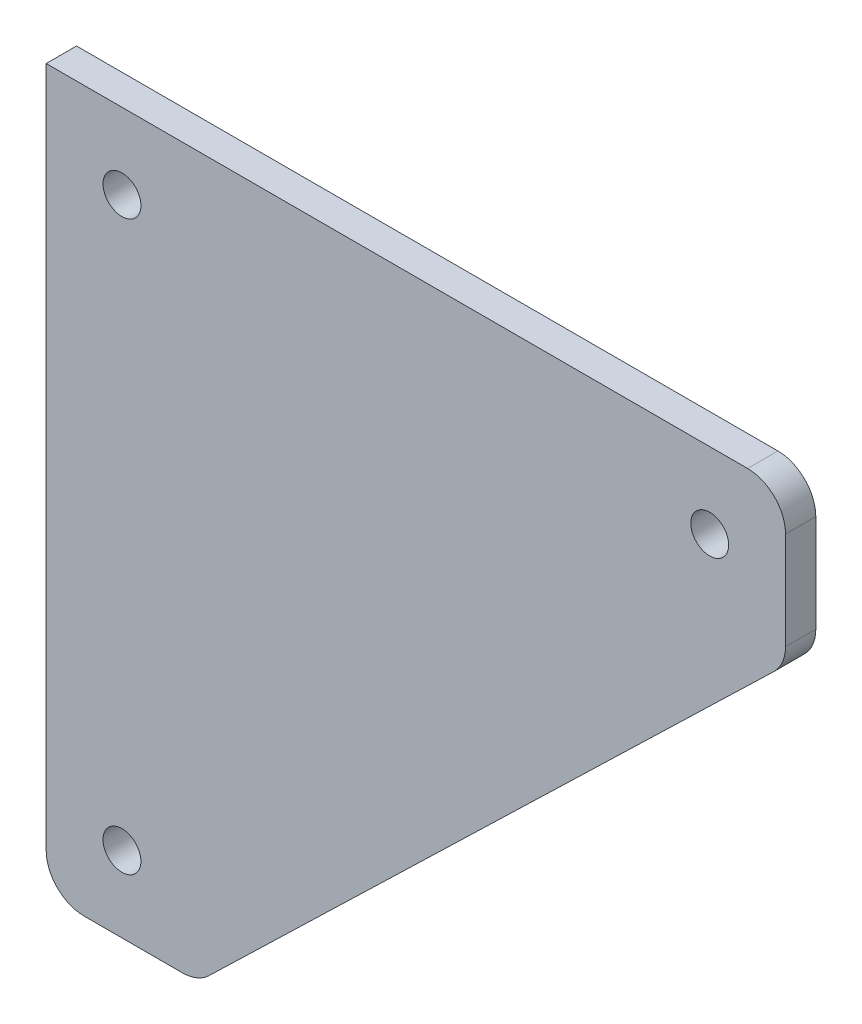
from build123d import *

# Parameters (mm, degrees)
BOSS_EXTRU_1_DEPTH      = 4
ESQUISSE2_R             = 2.5
ENL_V_MAT_EXTRU_1_DEPTH = 4
CONG_1_R                = 5


with BuildPart() as part:
    # Esquisse1 → Boss.-Extru.1 (new body)
    with BuildSketch(Plane.XY):
        Polygon((-46.45758945, 41.15105452), (51.118168125, 41.15105452), (51.118168125, 21.15105452), (-26.45758945, -53.798440429), (-46.45758945, -53.798440429), align=None)
    extrude(amount=BOSS_EXTRU_1_DEPTH)

    # Esquisse2 → Enlèv. mat.-Extru.1 (cut)
    with BuildSketch(Plane.XY.offset(4)):
        with Locations((-36.45758945, 31.15105452)):
            Circle(ESQUISSE2_R)
        with Locations((41.118168125, 31.15105452)):
            Circle(ESQUISSE2_R)
        with Locations((-36.45758945, -43.798440429)):
            Circle(ESQUISSE2_R)
    extrude(amount=-ENL_V_MAT_EXTRU_1_DEPTH, mode=Mode.SUBTRACT)

    # Congé1
    cong_1_edges = [part.edges().sort_by_distance(p)[0] for p in [
        (51.118168125, 41.15105452, 2),
        (51.118168125, 21.15105452, 2),
        (-26.45758945, -53.798440429, 2),
        (-46.45758945, -53.798440429, 2),
    ]]
    fillet(cong_1_edges, radius=CONG_1_R)


solid = part.part
